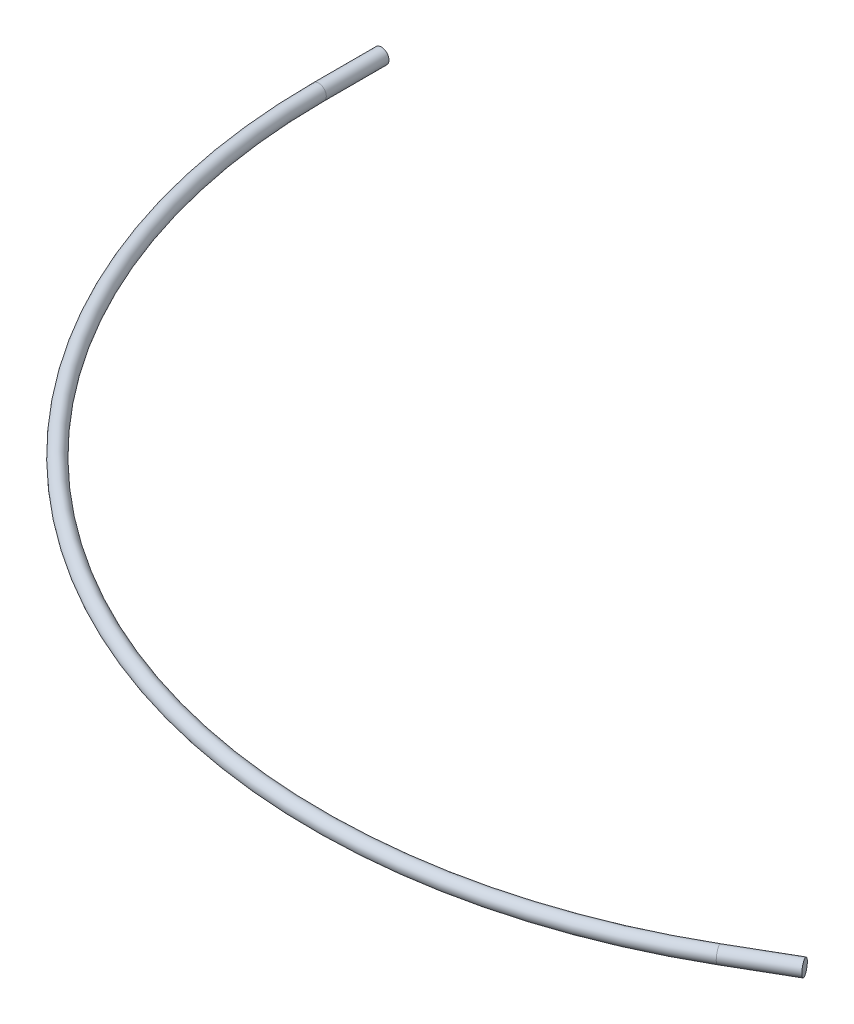
from build123d import *

# Parameters (mm, degrees)
SKETCH3_R           = 2.4
REVOLVE1_ANGLE      = 120
SKETCH4_R           = 2.4
BOSS_EXTRUDE1_DEPTH = 20
SKETCH5_R           = 2.4
BOSS_EXTRUDE2_DEPTH = 20


with BuildPart() as part:
    # Sketch3 → Revolve1 (revolve)
    with BuildSketch(Plane.XY):
        with Locations((-201.5, 0)):
            Circle(SKETCH3_R)
    revolve(axis=Axis((0, 0, 0), (0, 1, 0)), revolution_arc=REVOLVE1_ANGLE)

    # Sketch4 → Boss-Extrude1 (add)
    with BuildSketch(Plane(origin=(0, 0, 0), x_dir=(-0.5000000000000043, 0, -0.8660254037844363), z_dir=(0.8660254037844362, 0, -0.5000000000000042))):
        with Locations(Location((-201.5, 0, 0), (0, 0, 180))):
            Circle(SKETCH4_R)
    extrude(amount=BOSS_EXTRUDE1_DEPTH)

    # Sketch5 → Boss-Extrude2 (add)
    with BuildSketch(Plane(origin=(0, 0, 0), x_dir=(-1, 0, 0), z_dir=(0, 0, -1))):
        with Locations((201.5, 0)):
            Circle(SKETCH5_R)
    extrude(amount=BOSS_EXTRUDE2_DEPTH)


solid = part.part
